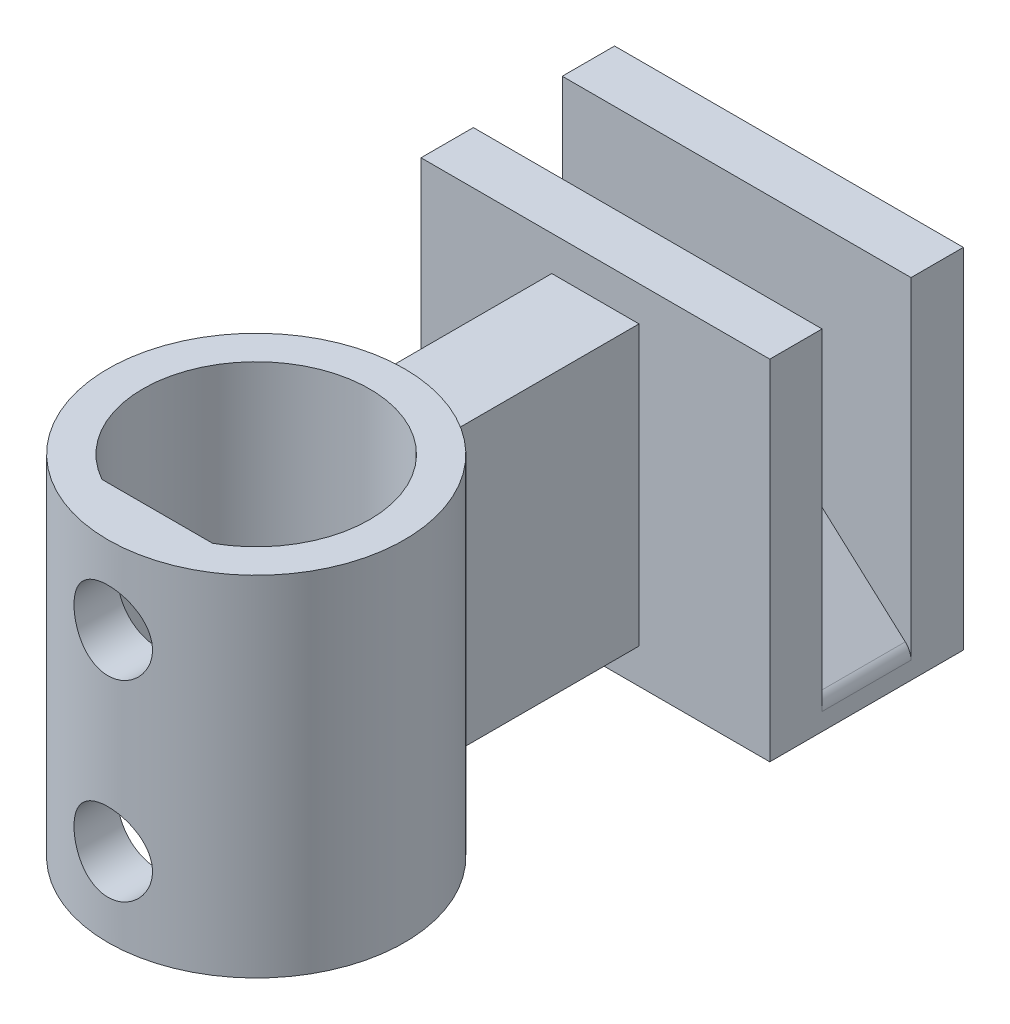
from build123d import *

# Parameters (mm, degrees)
SKETCH2_W                       = 20
SKETCH2_H                       = 10
BOSS_EXTRUDE1_DEPTH             = 2.55
CHAMFER1_SIZE                   = 9.5
CHAMFER1_SIZE2                  = 8.553838421
FILLET3_R                       = 1
SKETCH3_W                       = 20
SKETCH3_H                       = 20
BOSS_EXTRUDE2_DEPTH             = 3
BOSS_EXTRUDE3_REACH             = 20.863
SKETCH6_R                       = 8.5
BOSS_EXTRUDE3_DIRECTION_2_REACH = 20.863
BOSS_EXTRUDE4_REACH             = 35.26
BOSS_EXTRUDE4_END_RADIUS        = 8.5
SKETCH5_W                       = 5
SKETCH5_H                       = 16
CUT_EXTRUDE1_REACH              = 33.27
CUT_EXTRUDE1_END_RADIUS         = 8.5
SKETCH7_R                       = 2.25


with BuildPart() as part:
    # Sketch2 → Boss-Extrude1 (new, symmetric)
    with BuildSketch(Plane.XY):
        Rectangle(SKETCH2_W, SKETCH2_H)
    extrude(amount=BOSS_EXTRUDE1_DEPTH, both=True)

    # Chamfer1
    chamfer1_edges = [part.edges().sort_by_distance(p)[0] for p in [
        (-10, 5, 0),
        (10, 5, 0),
    ]]
    chamfer1_side = [part.faces().sort_by_distance(p)[0] for p in [
        (0, 5, 0),
    ]]
    chamfer(chamfer1_edges, length=CHAMFER1_SIZE, length2=CHAMFER1_SIZE2, reference=chamfer1_side[0])

    # Fillet3
    fillet3_edges = [part.edges().sort_by_distance(p)[0] for p in [
        (-0.5, 5, 0),
        (0.5, 5, 0),
        (10, -3.553838421, 0),
        (-10, -3.553838421, 0),
    ]]
    fillet(fillet3_edges, radius=FILLET3_R)

    # Sketch3 → Boss-Extrude2 (add)
    with BuildSketch(Plane.XY.offset(2.55)):
        with Locations((0, 5)):
            Rectangle(SKETCH3_W, SKETCH3_H)
    boss_extrude2 = extrude(amount=BOSS_EXTRUDE2_DEPTH)

    # Mirror1: Boss-Extrude2 across plane
    add(boss_extrude2.mirror(Plane.XY))


with BuildPart() as body_2:

    # Boss-Extrude3: up to this face of the body (flat: up to its plane)
    boss_extrude3_end = Plane(part.part.faces().sort_by_distance((0, 15, 4.05))[0])
    # Sketch6 → Boss-Extrude3 (new, up to the picked face)
    with BuildSketch(Plane(origin=(0, 0, 0), x_dir=(1, 0, 0), z_dir=(0, 1, 0)), mode=Mode.PRIVATE) as boss_extrude3_sk1:
        with Locations(Location((0, -25, 0), (0, 0, 90))):
            Circle(SKETCH6_R)
        with BuildLine():
            Line((-3.175, -30.671805268), (3.175, -30.671805268))
            ThreePointArc((3.175, -30.671805268), (0, -18.5), (-3.175, -30.671805268))
        make_face(mode=Mode.SUBTRACT)
    boss_extrude3_tool1 = split(extrude(boss_extrude3_sk1.sketch, amount=BOSS_EXTRUDE3_REACH, mode=Mode.PRIVATE), bisect_by=boss_extrude3_end, keep=Keep.BOTH, mode=Mode.PRIVATE)
    add(boss_extrude3_tool1.solids().sort_by(Axis((0, 0, 33.259584), (0, 1, 0)))[0])


    # Boss-Extrude3 direction 2: up to this face of the body (flat: up to its plane)
    boss_extrude3_direction_2_end = Plane(part.part.faces().sort_by_distance((0, -5, 0))[0])
    # Sketch6 → Boss-Extrude3 direction 2 (add, up to the picked face)
    with BuildSketch(Plane(origin=(0, 0, 0), x_dir=(1, 0, 0), z_dir=(0, 1, 0)), mode=Mode.PRIVATE) as boss_extrude3_direction_2_sk1:
        with Locations(Location((0, -25, 0), (0, 0, 90))):
            Circle(SKETCH6_R)
        with BuildLine():
            Line((-3.175, -30.671805268), (3.175, -30.671805268))
            ThreePointArc((3.175, -30.671805268), (0, -18.5), (-3.175, -30.671805268))
        make_face(mode=Mode.SUBTRACT)
    boss_extrude3_direction_2_tool1 = split(extrude(boss_extrude3_direction_2_sk1.sketch, amount=-BOSS_EXTRUDE3_DIRECTION_2_REACH, mode=Mode.PRIVATE), bisect_by=boss_extrude3_direction_2_end, keep=Keep.BOTH, mode=Mode.PRIVATE)
    add(boss_extrude3_direction_2_tool1.solids().sort_by(Axis((0, 0, 33.259584), (0, -1, 0)))[0])


with BuildPart() as part_1:
    add(part.part)

    add(body_2.part)  # Boss-Extrude4 merges body 2
    # Boss-Extrude4: up to this cylinder (the profile starts outside it)
    boss_extrude4_end = Plane(origin=(0, 5, 25), z_dir=(0, -1, 0)) * Cylinder(BOSS_EXTRUDE4_END_RADIUS, 88.52, mode=Mode.PRIVATE)
    # Sketch5 → Boss-Extrude4 (add, up to the surface)
    with BuildSketch(Plane.XY.offset(5.55), mode=Mode.PRIVATE) as boss_extrude4_sk1:
        with Locations((0, 5)):
            Rectangle(SKETCH5_W, SKETCH5_H)
    boss_extrude4_tool1 = extrude(boss_extrude4_sk1.sketch, amount=BOSS_EXTRUDE4_REACH, mode=Mode.PRIVATE) - boss_extrude4_end
    add(boss_extrude4_tool1.solids().sort_by_distance((0, 5, 5.55))[0])

    # Cut-Extrude1: up to this cylinder (the profile starts inside it)
    cut_extrude1_end = Plane(origin=(0, 5, 25), z_dir=(0, -1, 0)) * Cylinder(CUT_EXTRUDE1_END_RADIUS, 95.54, mode=Mode.PRIVATE)
    # Sketch7 → Cut-Extrude1 (cut, up to the surface)
    with BuildSketch(Plane.XY.offset(20), mode=Mode.PRIVATE) as cut_extrude1_sk1:
        with Locations(Location((0, 10.5, 0), (0, 0, 180))):
            Circle(SKETCH7_R)
    cut_extrude1_tool1 = extrude(cut_extrude1_sk1.sketch, amount=CUT_EXTRUDE1_REACH, mode=Mode.PRIVATE) & cut_extrude1_end
    add(cut_extrude1_tool1.solids().sort_by_distance((0, 10.5, 20))[0], mode=Mode.SUBTRACT)
    # Sketch7 → Cut-Extrude1 (cut, up to the surface)
    with BuildSketch(Plane.XY.offset(20), mode=Mode.PRIVATE) as cut_extrude1_sk2:
        with Locations(Location((0, -0.5, 0), (0, 0, 180))):
            Circle(SKETCH7_R)
    cut_extrude1_tool2 = extrude(cut_extrude1_sk2.sketch, amount=CUT_EXTRUDE1_REACH, mode=Mode.PRIVATE) & cut_extrude1_end
    add(cut_extrude1_tool2.solids().sort_by_distance((0, -0.5, 20))[0], mode=Mode.SUBTRACT)


solid = part_1.part
